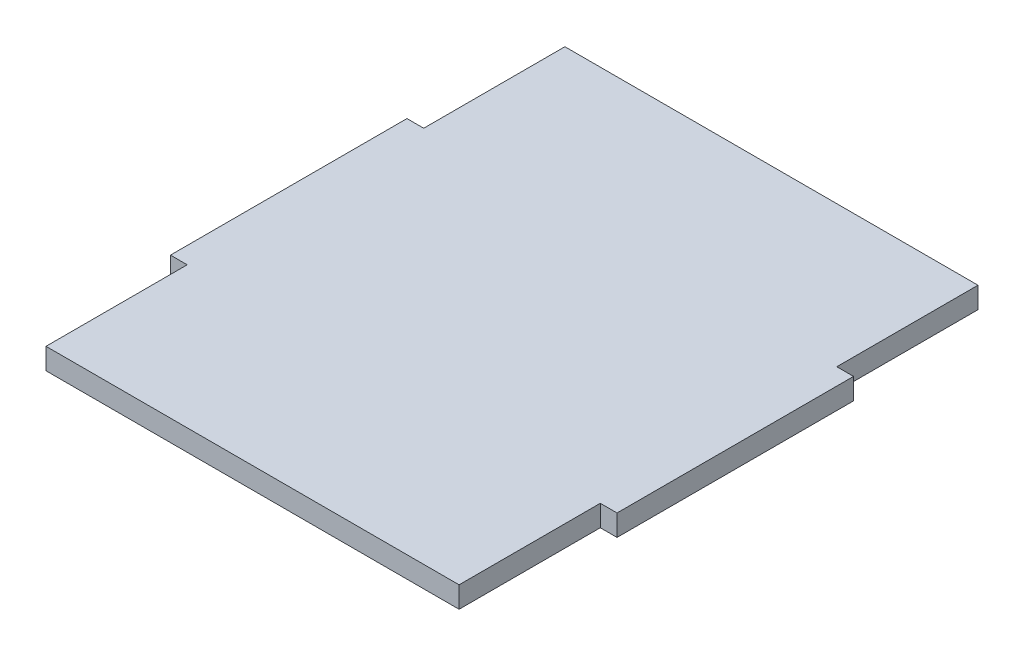
from build123d import *

# Parameters (mm, degrees)
SALIENTE_EXTRUIR1_DEPTH = 19


with BuildPart() as part:
    # Croquis1 → Saliente-Extruir1 (new body)
    with BuildSketch(Plane(origin=(0, 0, 0), x_dir=(1, 0, 0), z_dir=(0, 1, 0))):
        Polygon((-290.482080256, 184.53611465), (-290.482080256, 58.06611465), (-305.482080256, 58.06611465), (-305.482080256, -153.77388535), (-290.482080256, -153.77388535), (-290.482080256, -280.24388535), (79.517919744, -280.24388535), (79.517919744, -153.77388535), (94.517919744, -153.77388535), (94.517919744, 58.06611465), (79.517919744, 58.06611465), (79.517919744, 184.53611465), align=None)
    extrude(amount=SALIENTE_EXTRUIR1_DEPTH)


solid = part.part
